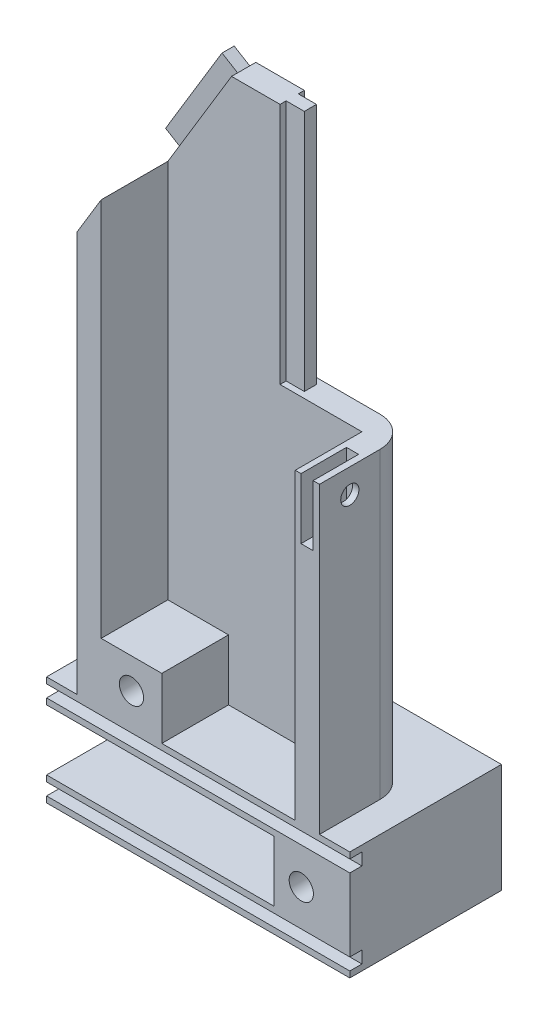
from build123d import *

# Parameters (mm, degrees)
SKETCH1_W                = 40
SKETCH1_H                = 30
BOSS_EXTRUDE1_DEPTH      = 90
SHELL1_T                 = -4
FILLET1_R                = 5
CUT_EXTRUDE1_DEPTH       = 94.407708461
CUT_EXTRUDE1_DEPTH_BACK  = 94.407708461
CUT_EXTRUDE2_DEPTH       = 94.407708461
CUT_EXTRUDE2_DEPTH_BACK  = 94.407708461
SKETCH3_W                = 17.5
SKETCH3_H                = 40
SKETCH5_W                = 2
SKETCH5_H                = 40
BOSS_EXTRUDE2_DEPTH      = 3
SKETCH6_W                = 2
SKETCH6_H                = 18
BOSS_EXTRUDE3_DEPTH      = 3
SKETCH8_W                = 50
SKETCH8_H                = 50
BOSS_EXTRUDE4_DEPTH      = 18
SKETCH10_W               = 45
SKETCH10_H               = 10
CUT_EXTRUDE4_DEPTH       = 37.5
BOSS_EXTRUDE5_REACH      = 103.502
SKETCH15_W               = 10
SKETCH15_H               = 10
CUT_EXTRUDE8_DEPTH       = 103.988587343
CUT_EXTRUDE8_DEPTH_BACK  = 103.988587343
SKETCH20_R               = 2
SKETCH21_R               = 4
CUT_EXTRUDE9_DEPTH       = 5
SKETCH23_W               = 2
SKETCH23_H               = 15
CUT_EXTRUDE10_DEPTH      = 10
CUT_EXTRUDE11_START      = -10
SKETCH24_R               = 1.5
CUT_EXTRUDE11_DEPTH      = 116.031657717
CUT_EXTRUDE12_DEPTH      = 99.140965569
CUT_EXTRUDE12_DEPTH_BACK = 99.140965569
SKETCH27_W               = 50
SKETCH27_H               = 25
SKETCH29_W               = 50
SKETCH29_H               = 2
CUT_EXTRUDE13_DEPTH      = 2
SKETCH30_W               = 50
SKETCH30_H               = 2
CUT_EXTRUDE14_DEPTH      = 2
CUT_EXTRUDE15_DEPTH      = 99.140965569
CUT_EXTRUDE15_DEPTH_BACK = 99.140965569
SKETCH31_R               = 2
SKETCH33_R               = 4
CUT_EXTRUDE16_DEPTH      = 15


with BuildPart() as part:
    # Sketch1 → Boss-Extrude1 (new body)
    with BuildSketch(Plane(origin=(0, 0, 0), x_dir=(1, 0, 0), z_dir=(0, 1, 0))):
        Rectangle(SKETCH1_W, SKETCH1_H)
    extrude(amount=BOSS_EXTRUDE1_DEPTH)

    # Shell1
    shell1_openings = [part.faces().sort_by_distance(p)[0] for p in [
        (0, 90, 0),
        (0, 0, 0),
    ]]
    offset(amount=SHELL1_T, openings=shell1_openings, kind=Kind.INTERSECTION)

    # Fillet1
    fillet1_edges = [part.edges().sort_by_distance(p)[0] for p in [
        (20, 45, 15),
        (-20, 45, 15),
        (-20, 45, -15),
        (20, 45, -15),
    ]]
    fillet(fillet1_edges, radius=FILLET1_R)

    # Sketch2 → Cut-Extrude1 (cut, two sides: drawn at the far end of the back side and taken through both)
    with BuildSketch(Plane.XY.offset(-CUT_EXTRUDE1_DEPTH_BACK)):
        Polygon((-5.5, 90), (-20, 66), (-20, 90), align=None)
    extrude(amount=CUT_EXTRUDE1_DEPTH + CUT_EXTRUDE1_DEPTH_BACK, mode=Mode.SUBTRACT)

    # Sketch3 → Cut-Extrude2 (cut, two sides: drawn at the far end of the back side and taken through both)
    with BuildSketch(Plane.XY.offset(-CUT_EXTRUDE2_DEPTH_BACK)):
        with Locations((11.25, 70)):
            Rectangle(SKETCH3_W, SKETCH3_H)
    extrude(amount=CUT_EXTRUDE2_DEPTH + CUT_EXTRUDE2_DEPTH_BACK, mode=Mode.SUBTRACT)

    # Sketch5 → Boss-Extrude2 (add)
    with BuildSketch(Plane(origin=(2.5, 0, 0), x_dir=(0, 0, -1), z_dir=(1, 0, 0))):
        with Locations((-13, 70)):
            Rectangle(SKETCH5_W, SKETCH5_H)
    boss_extrude2 = extrude(amount=BOSS_EXTRUDE2_DEPTH)

    # Mirror1: Boss-Extrude2 across plane
    add(boss_extrude2.mirror(Plane.XY))

    # Sketch6 → Boss-Extrude3 (add)
    with BuildSketch(Plane(origin=(-43.86391097, 26.501112878, 0), x_dir=(0, 0, 1), z_dir=(-0.8559155419457906, 0.5171156399255814, 0))):
        with Locations((-13, 65.188262756)):
            Rectangle(SKETCH6_W, SKETCH6_H)
    boss_extrude3 = extrude(amount=BOSS_EXTRUDE3_DEPTH)

    # Mirror2: Boss-Extrude3 across plane
    add(boss_extrude3.mirror(Plane.XY))

    # Sketch8 → Boss-Extrude4 (add)
    with BuildSketch(Plane(origin=(0, 0, 0), x_dir=(1, 0, 0), z_dir=(0, 1, 0))):
        Rectangle(SKETCH8_W, SKETCH8_H)
    extrude(amount=-BOSS_EXTRUDE4_DEPTH)

    # Sketch10 → Cut-Extrude4 (cut)
    with BuildSketch(Plane.ZY.offset(25)):
        with Locations((0, -9)):
            Rectangle(SKETCH10_W, SKETCH10_H)
    extrude(amount=-CUT_EXTRUDE4_DEPTH, mode=Mode.SUBTRACT)

    # Sketch15 → Boss-Extrude5 (add, up to next)
    with BuildSketch(Plane.XY.offset(-11), mode=Mode.PRIVATE) as boss_extrude5_sk1:
        with Locations((-11, 5)):
            Rectangle(SKETCH15_W, SKETCH15_H)
    boss_extrude5_tool1 = extrude(boss_extrude5_sk1.sketch, amount=BOSS_EXTRUDE5_REACH, mode=Mode.PRIVATE) - part.part
    add(boss_extrude5_tool1.solids().sort_by_distance((-11, 5, -11))[0])

    # Sketch20 → Cut-Extrude8 (cut, two sides: drawn at the far end of the back side and taken through both)
    with BuildSketch(Plane(origin=(0, 0, -15), x_dir=(-1, 0, 0), z_dir=(0, 0, -1)).offset(-CUT_EXTRUDE8_DEPTH_BACK)):
        with Locations((11, 5)):
            Circle(SKETCH20_R)
    extrude(amount=CUT_EXTRUDE8_DEPTH + CUT_EXTRUDE8_DEPTH_BACK, mode=Mode.SUBTRACT)

    # Sketch21 → Cut-Extrude9 (cut)
    with BuildSketch(Plane(origin=(0, 0, -15), x_dir=(-1, 0, 0), z_dir=(0, 0, -1))):
        with Locations((11, 5)):
            Circle(SKETCH21_R)
    cut_extrude9 = extrude(amount=-CUT_EXTRUDE9_DEPTH, mode=Mode.SUBTRACT)

    # Mirror3: Cut-Extrude9 across plane
    add(cut_extrude9.mirror(Plane.XY), mode=Mode.SUBTRACT)

    # Sketch23 → Cut-Extrude10 (cut)
    with BuildSketch(Plane(origin=(0, 50, 0), x_dir=(1, 0, 0), z_dir=(0, 1, 0))):
        with Locations((17.949489743, 0)):
            Rectangle(SKETCH23_W, SKETCH23_H)
    extrude(amount=-CUT_EXTRUDE10_DEPTH, mode=Mode.SUBTRACT)

    # Sketch24 → Cut-Extrude11 (cut)
    with BuildSketch(Plane(origin=(20, 0, 0), x_dir=(0, 0, -1), z_dir=(1, 0, 0)).offset(CUT_EXTRUDE11_START)):
        with Locations(Location((-5, 46, 0), (0, 0, 180))):
            Circle(SKETCH24_R)
    cut_extrude11 = extrude(amount=CUT_EXTRUDE11_DEPTH, mode=Mode.SUBTRACT)

    # Mirror4: Cut-Extrude11 across plane
    add(cut_extrude11.mirror(Plane.XY), mode=Mode.SUBTRACT)

    # Sketch27 → Cut-Extrude12 (cut, two sides: drawn at the far end of the back side and taken through both)
    with BuildSketch(Plane(origin=(0, 0, 0), x_dir=(1, 0, 0), z_dir=(0, 1, 0)).offset(-CUT_EXTRUDE12_DEPTH_BACK)):
        with Locations((0, -12.5)):
            Rectangle(SKETCH27_W, SKETCH27_H)
    extrude(amount=CUT_EXTRUDE12_DEPTH + CUT_EXTRUDE12_DEPTH_BACK, mode=Mode.SUBTRACT)

    # Sketch29 → Cut-Extrude13 (cut)
    with BuildSketch(Plane.XY):
        with Locations((0, -2)):
            Rectangle(SKETCH29_W, SKETCH29_H)
    extrude(amount=-CUT_EXTRUDE13_DEPTH, mode=Mode.SUBTRACT)

    # Sketch30 → Cut-Extrude14 (cut)
    with BuildSketch(Plane.XY):
        with Locations((0, -16)):
            Rectangle(SKETCH30_W, SKETCH30_H)
    extrude(amount=-CUT_EXTRUDE14_DEPTH, mode=Mode.SUBTRACT)

    # Sketch31 → Cut-Extrude15 (cut, two sides: drawn at the far end of the back side and taken through both)
    with BuildSketch(Plane.XY.offset(-CUT_EXTRUDE15_DEPTH_BACK)):
        with Locations((17, -9)):
            Circle(SKETCH31_R)
    extrude(amount=CUT_EXTRUDE15_DEPTH + CUT_EXTRUDE15_DEPTH_BACK, mode=Mode.SUBTRACT)

    # Sketch33 → Cut-Extrude16 (cut)
    with BuildSketch(Plane(origin=(0, 0, -25), x_dir=(-1, 0, 0), z_dir=(0, 0, -1))):
        with Locations((-17, -9)):
            Circle(SKETCH33_R)
    extrude(amount=-CUT_EXTRUDE16_DEPTH, mode=Mode.SUBTRACT)


solid = part.part
